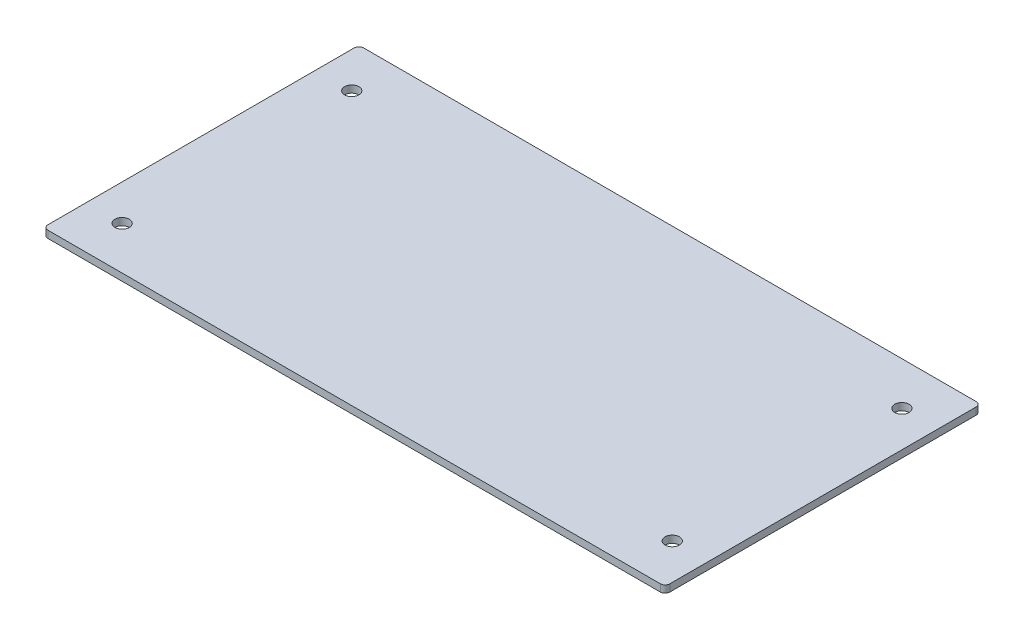
from build123d import *

# Parameters (mm, degrees)
ESQUISSE1_W        = 130
ESQUISSE1_H        = 66
ESQUISSE1_R        = 1.5
BOSS_EXTRU_1_DEPTH = 1.5
CONG_1_R           = 1


with BuildPart() as part:
    # Esquisse1 → Boss.-Extru.1 (new body)
    with BuildSketch(Plane(origin=(0, 0, 0), x_dir=(1, 0, 0), z_dir=(0, 1, 0))):
        Rectangle(ESQUISSE1_W, ESQUISSE1_H)
        with Locations(Location((57.5, 24, 0), (0, 0, 270))):
            Circle(ESQUISSE1_R, mode=Mode.SUBTRACT)
        with Locations(Location((-57.5, 24, 0), (0, 0, 90))):
            Circle(ESQUISSE1_R, mode=Mode.SUBTRACT)
        with Locations(Location((-57.5, -24, 0), (0, 0, 270))):
            Circle(ESQUISSE1_R, mode=Mode.SUBTRACT)
        with Locations(Location((57.5, -24, 0), (0, 0, 90))):
            Circle(ESQUISSE1_R, mode=Mode.SUBTRACT)
    extrude(amount=BOSS_EXTRU_1_DEPTH)

    # Congé1
    cong_1_edges = [part.edges().sort_by_distance(p)[0] for p in [
        (-65, 0.75, -33),
        (65, 0.75, -33),
        (65, 0.75, 33),
        (-65, 0.75, 33),
    ]]
    fillet(cong_1_edges, radius=CONG_1_R)


solid = part.part
